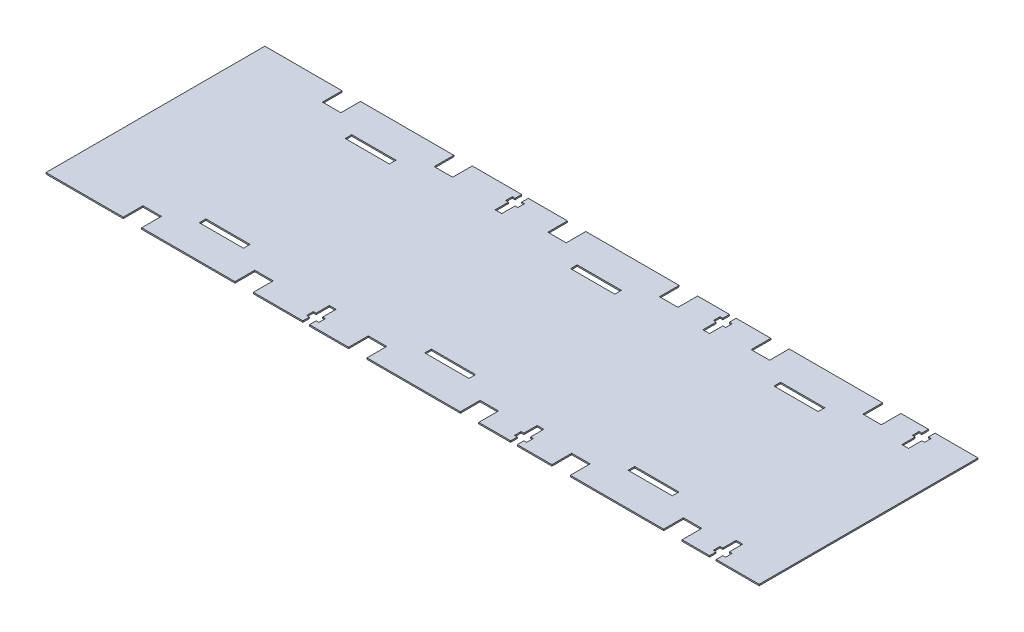
from build123d import *

# Parameters (mm, degrees)
SKETCH1_W           = 96.800297879
SKETCH1_H           = 14.479859902
SKETCH1_H_2         = 14.476525066
SKETCH1_W_2         = 96.796963042
SKETCH1_H_3         = 14.526547613
SKETCH1_H_4         = 14.51987794
BOSS_EXTRUDE1_DEPTH = 3


with BuildPart() as part:
    # Sketch1 → Boss-Extrude1 (new body)
    with BuildSketch(Plane(origin=(0, 0, 0), x_dir=(1, 0, 0), z_dir=(0, 1, 0))):
        Polygon((686.70035272, 239.579653428), (686.70035272, 225.059775488), (692.749746056, 225.059775488), (692.749746056, 210.533227875), (686.70035272, 210.533227875), (686.70035272, 181.491804577), (672.178807362, 181.491804577), (672.178807362, 210.533227875), (666.129414026, 210.533227875), (666.129414026, 225.059775488), (672.178807362, 225.059775488), (672.178807362, 239.579653428), (612.025027325, 239.579653428), (612.025027325, 196.600281152), (571.723528724, 196.600281152), (571.723528724, 239.579653428), (367.346408951, 239.579653428), (367.346408951, 196.600281152), (327.043242933, 196.600281152), (327.043242933, 239.579653428), (251.100679683, 239.579653428), (251.100679683, 225.059775488), (257.150073019, 225.059775488), (257.150073019, 210.533227875), (251.100679683, 210.533227875), (251.100679683, 181.491804577), (236.579134325, 181.491804577), (236.579134325, 210.533227875), (230.529740989, 210.533227875), (230.529740989, 225.059775488), (236.579134325, 225.059775488), (236.579134325, 239.579653428), (166.747658885, 239.579653428), (166.747658885, 196.600281152), (126.446160285, 196.600281152), (126.446160285, 239.579653428), (-77.92929207, 239.579653428), (-77.92929207, 196.600281152), (-118.232458088, 196.600281152), (-118.232458088, 239.579653428), (-203.85271674, 239.579653428), (-203.85271674, 225.059775488), (-197.803323405, 225.059775488), (-197.803323405, 210.533227875), (-203.85271674, 210.533227875), (-203.85271674, 181.491804577), (-218.374262098, 181.491804577), (-218.374262098, 210.533227875), (-224.425322852, 210.533227875), (-224.425322852, 225.059775488), (-218.374262098, 225.059775488), (-218.374262098, 239.579653428), (-326.669741249, 239.579653428), (-326.669741249, 196.600281152), (-366.97123985, 196.600281152), (-366.97123985, 239.579653428), (-571.348359623, 239.579653428), (-571.348359623, 196.600281152), (-611.649858223, 196.600281152), (-611.649858223, 239.579653428), (-780.777756631, 239.579653428), (-780.777756631, -239.579653428), (-611.649858223, -239.579653428), (-611.649858223, -196.323489726), (-571.348359623, -196.323489726), (-571.348359623, -239.579653428), (-366.97123985, -239.579653428), (-366.97123985, -196.323489726), (-326.669741249, -196.323489726), (-326.669741249, -239.579653428), (-218.374262098, -239.579653428), (-218.374262098, -225.059775488), (-224.425322852, -225.059775488), (-224.425322852, -210.539897548), (-218.374262098, -210.539897548), (-218.374262098, -181.500141668), (-203.85271674, -181.500141668), (-203.85271674, -210.539897548), (-197.803323405, -210.539897548), (-197.803323405, -225.059775488), (-203.85271674, -225.059775488), (-203.85271674, -239.579653428), (-118.232458088, -239.579653428), (-118.232458088, -196.323489726), (-77.92929207, -196.323489726), (-77.92929207, -239.579653428), (126.446160285, -239.579653428), (126.446160285, -196.323489726), (166.747658885, -196.323489726), (166.747658885, -239.579653428), (236.582469161, -239.579653428), (236.582469161, -225.059775488), (230.533075826, -225.059775488), (230.533075826, -210.539897548), (236.582469161, -210.539897548), (236.582469161, -181.500141668), (251.102347101, -181.500141668), (251.102347101, -210.539897548), (257.151740437, -210.539897548), (257.151740437, -225.059775488), (251.102347101, -225.059775488), (251.102347101, -239.579653428), (327.046577769, -239.579653428), (327.046577769, -196.323489726), (367.349743788, -196.323489726), (367.349743788, -239.579653428), (571.716859051, -239.579653428), (571.716859051, -196.323489726), (612.02002507, -196.323489726), (612.02002507, -239.579653428), (672.172137689, -239.579653428), (672.172137689, -225.059775488), (666.121076935, -225.059775488), (666.121076935, -210.539897548), (672.172137689, -210.539897548), (672.172137689, -181.500141668), (686.692015629, -181.500141668), (686.692015629, -210.539897548), (692.741408964, -210.539897548), (692.741408964, -225.059775488), (686.692015629, -225.059775488), (686.692015629, -239.579653428), (780.777756631, -239.579653428), (780.777756631, 239.579653428), align=None)
        Polygon((-421.022269168, -166.9502502), (-517.822567047, -166.9502502), (-517.822567047, -152.470390298), (-421.023936586, -152.470390298), align=None, mode=Mode.SUBTRACT)
        Polygon((-421.022269168, 152.497068989), (-517.822567047, 152.497068989), (-517.822567047, 166.973594055), (-421.023936586, 166.973594055), align=None, mode=Mode.SUBTRACT)
        with Locations((24.258434108, -159.710320249)):
            Rectangle(SKETCH1_W, SKETCH1_H, mode=Mode.SUBTRACT)
        with Locations((24.258434108, 159.735331522)):
            Rectangle(SKETCH1_W, SKETCH1_H_2, mode=Mode.SUBTRACT)
        with Locations((469.537469965, -159.686976394)):
            Rectangle(SKETCH1_W_2, SKETCH1_H_3, mode=Mode.SUBTRACT)
        with Locations((469.537469965, 159.757007959)):
            Rectangle(SKETCH1_W_2, SKETCH1_H_4, mode=Mode.SUBTRACT)
    extrude(amount=BOSS_EXTRUDE1_DEPTH)


solid = part.part
